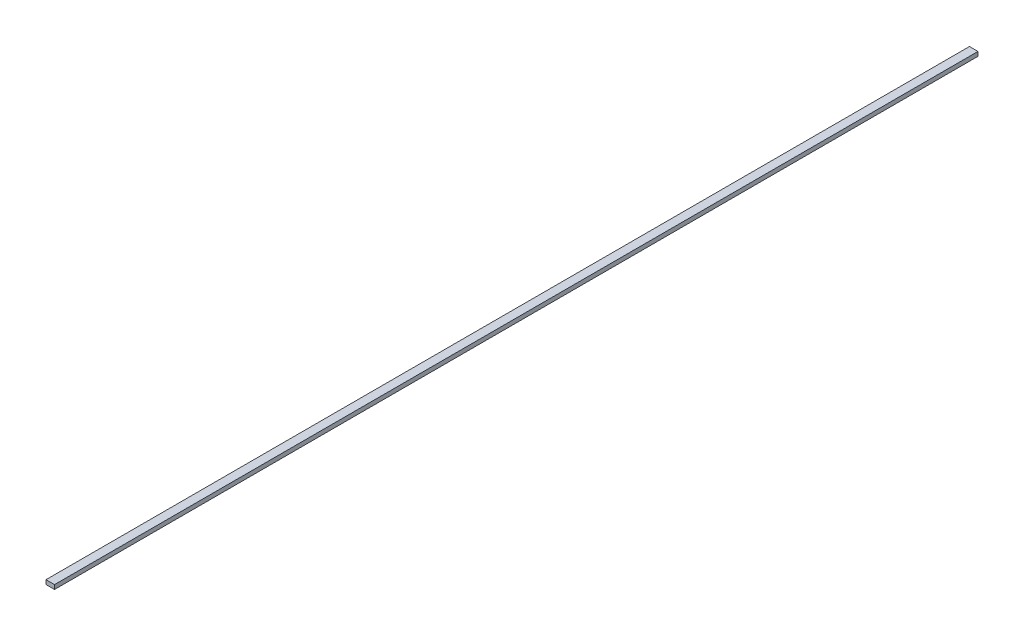
from build123d import *

# Parameters (mm, degrees)
DET2_KAYIS_GT3_6MM_1_START = -40
SKETCH1_W                  = 6
SKETCH1_H                  = 3
DET2_KAYIS_GT3_6MM_1_DEPTH = 650


with BuildPart() as part:
    # Sketch1 → DET2_kayis_GT3_6mm_1 (new body)
    with BuildSketch(Plane.XY.offset(DET2_KAYIS_GT3_6MM_1_START)):
        with Locations((720, 1551.5)):
            Rectangle(SKETCH1_W, SKETCH1_H)
    extrude(amount=-DET2_KAYIS_GT3_6MM_1_DEPTH)


solid = part.part
